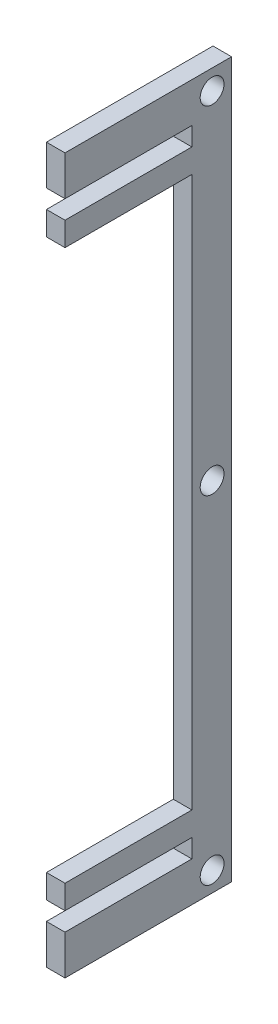
from build123d import *

# Parameters (mm, degrees)
SKETCH1_W           = 114.3
SKETCH1_H           = 26.643356644
BOSS_EXTRUDE1_DEPTH = 2.9718
SKETCH2_W           = 2.9718
SKETCH2_H           = 20.293356644
SKETCH2_W_2         = 88.0364
CUT_EXTRUDE1_DEPTH  = 3.175
SKETCH3_R           = 1.905
CUT_EXTRUDE2_DEPTH  = 3.175


with BuildPart() as part:
    # Sketch1 → Boss-Extrude1 (new body)
    with BuildSketch(Plane.YZ):
        Rectangle(SKETCH1_W, SKETCH1_H)
    extrude(amount=BOSS_EXTRUDE1_DEPTH)

    # Sketch2 → Cut-Extrude1 (cut)
    with BuildSketch(Plane.YZ.offset(2.9718)):
        with Locations((-49.3141, 3.175)):
            Rectangle(SKETCH2_W, SKETCH2_H)
        with Locations((49.3141, 3.175)):
            Rectangle(SKETCH2_W, SKETCH2_H)
        with Locations((0, 3.175)):
            Rectangle(SKETCH2_W_2, SKETCH2_H)
    extrude(amount=-CUT_EXTRUDE1_DEPTH, mode=Mode.SUBTRACT)

    # Sketch3 → Cut-Extrude2 (cut)
    with BuildSketch(Plane.YZ.offset(2.9718)):
        with Locations(Location((0, -10.209266023, 0), (0, 0, 270))):
            Circle(SKETCH3_R)
        with Locations(Location((-53.975, -10.209266023, 0), (0, 0, 270))):
            Circle(SKETCH3_R)
        with Locations(Location((53.975, -10.209266023, 0), (0, 0, 270))):
            Circle(SKETCH3_R)
    extrude(amount=-CUT_EXTRUDE2_DEPTH, mode=Mode.SUBTRACT)


solid = part.part
